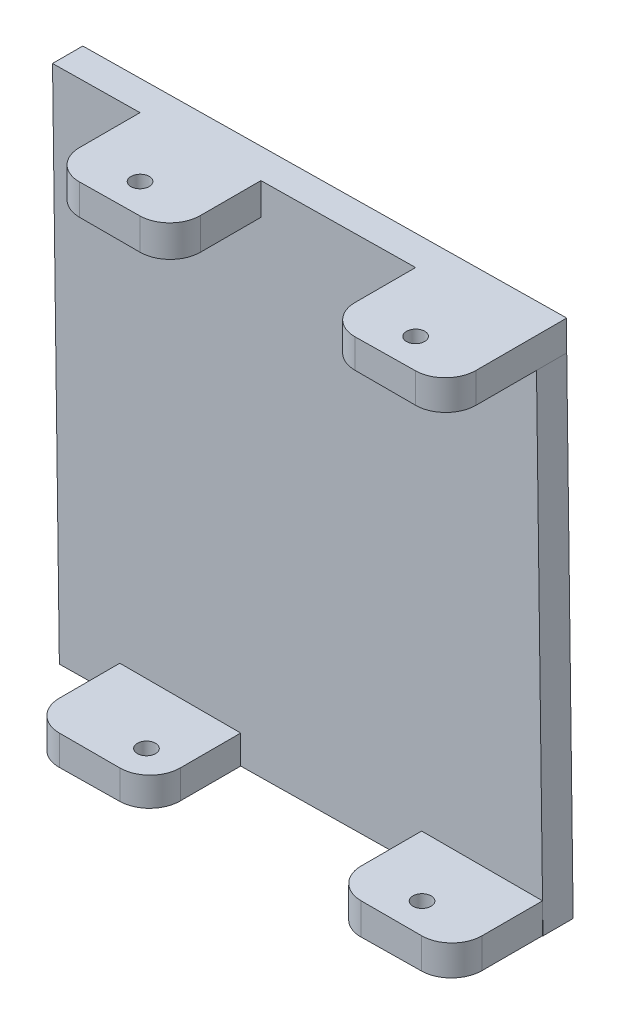
from build123d import *

# Parameters (mm, degrees)
BOSS_EXTRUDE1_DEPTH   = 5
BOSS_EXTRUDE2_DEPTH   = 20
FILLET1_R             = 5
F_3_0MM_DOWEL_HOLE1_D = 3


with BuildPart() as part:
    # Sketch1 → Boss-Extrude1 (new body)
    with BuildSketch(Plane.XY):
        Polygon((-47.026906911, 0), (32.973093089, 1.057571587), (31.842813456, 86.557571587), (-48.157186544, 85.5), align=None)
    extrude(amount=BOSS_EXTRUDE1_DEPTH)

    # Sketch2 → Boss-Extrude2 (add)
    with BuildSketch(Plane.XY):
        Polygon((-33.681834279, 85.691359016), (-33.681834279, 80.691359016), (-13.681834279, 80.691359016), (-13.681834279, 85.955751912), align=None)
        Polygon((11.908900131, 86.294052332), (11.908900131, 81.558445229), (31.908900131, 81.558445229), (31.908900131, 86.558445229), align=None)
        Polygon((-37.027780592, 0.132184899), (-37.027780592, 5.132184899), (-17.027780592, 5.132184899), (-17.027780592, 0.396577795), align=None)
        Polygon((12.907006414, 0.792305048), (12.907006414, 6.056697944), (32.907006414, 6.056697944), (32.907006414, 1.056697944), align=None)
    extrude(amount=BOSS_EXTRUDE2_DEPTH)

    # Fillet1
    fillet1_edges = [part.edges().sort_by_distance(p)[0] for p in [
        (-33.681834279, 83.191359016, 20),
        (-13.681834279, 83.323555464, 20),
        (31.908900131, 84.058445229, 20),
        (11.908900131, 83.926248781, 20),
        (-17.027780592, 2.764381347, 20),
        (-37.027780592, 2.632184899, 20),
        (32.907006414, 3.556697944, 20),
        (12.907006414, 3.424501496, 20),
    ]]
    fillet(fillet1_edges, radius=FILLET1_R)

    # Ø3.0mm Dowel Hole1 (through all)
    with Locations(Plane(origin=(-1.138496573, 86.121570382, 0), x_dir=(0.9999126319463549, 0.013218489857520067, 0), z_dir=(-0.013218489857520067, 0.9999126319463549, 0))):
        with Locations((-22.546181203, -15), (23.048536729, -15)):
            Hole(F_3_0MM_DOWEL_HOLE1_D / 2)


solid = part.part
